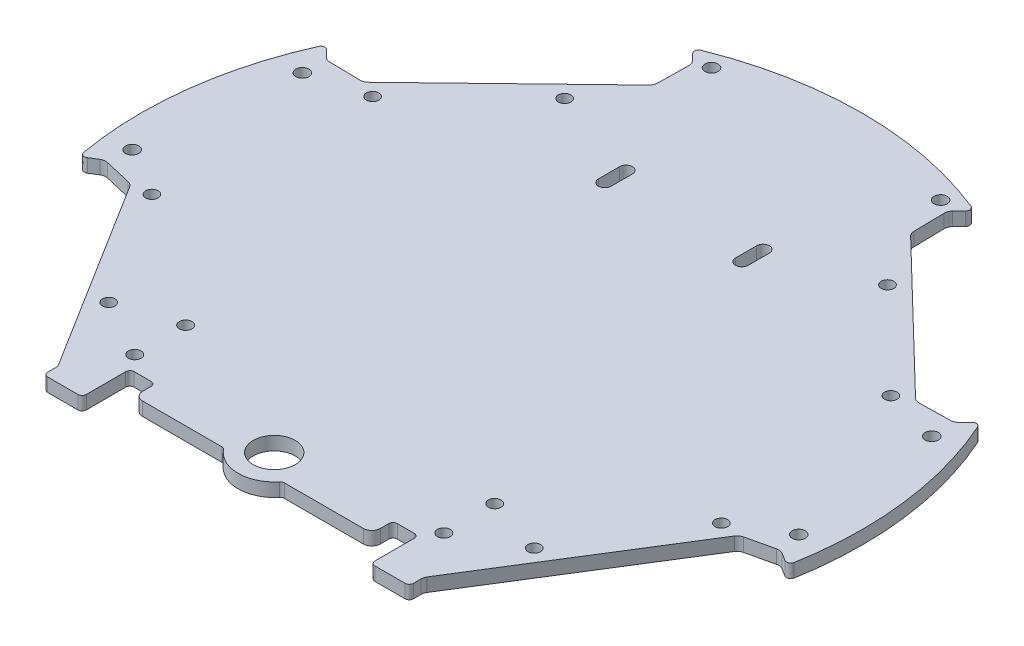
from build123d import *

# Parameters (mm, degrees)
BOSS_EXTRUDE4_DEPTH  = 3.175
SKETCH17_R           = 8.5
BOSS_EXTRUDE5_DEPTH  = 3.175
M3_CLEARANCE_HOLE3_D = 3
M3_CLEARANCE_HOLE1_D = 3.1
M3_CLEARANCE_HOLE4_D = 2.95
M3_CLEARANCE_HOLE2_D = 3.1
CUT_EXTRUDE1_DEPTH   = 121.250075364
BOSS_EXTRUDE6_DEPTH  = 3.175
FILLET1_R            = 2
FILLET3_R            = 1
SKETCH23_R           = 4.95
CUT_EXTRUDE2_DEPTH   = 121.250075364


with BuildPart() as part:
    # Sketch1 → Boss-Extrude4 (new body)
    with BuildSketch(Plane(origin=(0, 0, 0), x_dir=(1, 0, 0), z_dir=(0, 1, 0))):
        with BuildLine():
            Line((-62.799553621, 32.496136604), (-73.969425011, 32.691107434))
            Line((-73.969425011, 32.691107434), (-77.053684287, 35.88495141))
            ThreePointArc((-77.053684287, 35.88495141), (-84.36642289, 10.358894189), (-83.446216027, -16.178041625))
            Line((-83.446216027, -16.178041625), (-79.680911643, -13.825218315))
            Line((-79.680911643, -13.825218315), (-69.484649137, -16.179210996))
            Line((-69.484649137, -16.179210996), (-43.094490772, -58.412292655))
            Line((-43.094490772, -58.412292655), (-43.094490772, -64.826600275))
            Line((-43.094490772, -64.826600275), (-34, -64.826600275))
            Line((-34, -64.826600275), (-34, -58.55))
            Line((-34, -58.55), (-34, -53.55))
            Line((-34, -53.55), (-28, -53.55))
            Line((-28, -53.55), (-28, -58.55))
            Line((-28, -58.55), (28, -58.55))
            Line((28, -58.55), (28, -53.55))
            Line((28, -53.55), (34, -53.55))
            Line((34, -53.55), (34, -58.55))
            Line((34, -58.55), (34, -64.826600275))
            Line((34, -64.826600275), (43.094490772, -64.826600275))
            Line((43.094490772, -64.826600275), (43.094490772, -58.412292655))
            Line((43.094490772, -58.412292655), (69.484649137, -16.179210996))
            Line((69.484649137, -16.179210996), (79.680911643, -13.825218315))
            Line((79.680911643, -13.825218315), (83.446216027, -16.178041625))
            ThreePointArc((83.446216027, -16.178041625), (84.610662337, -8.126242604), (85, 0))
            ThreePointArc((85, 0), (82.98964744, 18.377116688), (77.053684287, 35.88495141))
            Line((77.053684287, 35.88495141), (73.969425011, 32.691107434))
            Line((73.969425011, 32.691107434), (62.799553621, 32.496136604))
            Line((62.799553621, 32.496136604), (30.284668021, 63.895396642))
            Line((30.284668021, 63.895396642), (30.089697191, 75.065268032))
            Line((30.089697191, 75.065268032), (33.173956467, 78.259112008))
            ThreePointArc((33.173956467, 78.259112008), (0, 85), (-33.173956467, 78.259112008))
            Line((-33.173956467, 78.259112008), (-30.089697191, 75.065268032))
            Line((-30.089697191, 75.065268032), (-30.284668021, 63.895396642))
            Line((-30.284668021, 63.895396642), (-62.799553621, 32.496136604))
        make_face()
    extrude(amount=BOSS_EXTRUDE4_DEPTH)

    # Sketch17 → Boss-Extrude5 (add)
    with BuildSketch(Plane(origin=(0, 3.175, 0), x_dir=(1, 0, 0), z_dir=(0, 1, 0))):
        with Locations((0, -53.55)):
            Circle(SKETCH17_R)
    extrude(amount=-BOSS_EXTRUDE5_DEPTH)

    # M3 Clearance Hole3 (through all)
    with Locations(Plane(origin=(0, 0, 0), x_dir=(-1, 0, 0), z_dir=(0, -1, 0))):
        with Locations((36.415, -50), (36.415, -38), (-36.415, -50), (-36.415, -38)):
            Hole(M3_CLEARANCE_HOLE3_D / 2)

    # M3 Clearance Hole1 (through all)
    with Locations(Plane(origin=(0, 3.175, 0), x_dir=(1, 0, 0), z_dir=(0, 1, 0))):
        with Locations((-78.542321426, -8.49139241), (78.542321426, -8.49139241), (74.155025063, 27.240269049), (-74.155025063, 27.240269049)):
            Hole(M3_CLEARANCE_HOLE1_D / 2)

    # M3 Clearance Hole4 (through all)
    with Locations(Plane(origin=(0, 0, 0), x_dir=(-1, 0, 0), z_dir=(0, -1, 0))):
        with Locations((-67.099301622, -15.278865202), (-50.141885166, -42.416404279), (-61.062544382, 30.698137949), (-38.043670771, 52.927205804), (50.141885166, -42.416404279), (67.099301622, -15.278865202), (38.043670771, 52.927205804), (61.062544382, 30.698137949)):
            Hole(M3_CLEARANCE_HOLE4_D / 2)

    # M3 Clearance Hole2 (through all)
    with Locations(Plane(origin=(0, 3.175, 0), x_dir=(1, 0, 0), z_dir=(0, 1, 0))):
        with Locations((27, 76.497766718), (-27, 76.497766718)):
            Hole(M3_CLEARANCE_HOLE2_D / 2)

    # Sketch20 → Cut-Extrude1 (cut, through all)
    with BuildSketch(Plane(origin=(0, 3.175, 0), x_dir=(1, 0, 0), z_dir=(0, 1, 0))):
        with BuildLine():
            Line((-14.64850035, 45.5), (-14.64850035, 40.5))
            ThreePointArc((-14.64850035, 40.5), (-16.14850035, 39), (-17.64850035, 40.5))
            Line((-17.64850035, 40.5), (-17.64850035, 45.5))
            ThreePointArc((-17.64850035, 45.5), (-16.14850035, 47), (-14.64850035, 45.5))
        make_face()
        with BuildLine():
            Line((14.64850035, 45.5), (14.64850035, 40.5))
            ThreePointArc((14.64850035, 40.5), (16.14850035, 39), (17.64850035, 40.5))
            Line((17.64850035, 40.5), (17.64850035, 45.5))
            ThreePointArc((17.64850035, 45.5), (16.14850035, 47), (14.64850035, 45.5))
        make_face()
    extrude(amount=-CUT_EXTRUDE1_DEPTH, mode=Mode.SUBTRACT)

    # Sketch22 → Boss-Extrude6 (add)
    with BuildSketch(Plane(origin=(0, 3.175, 0), x_dir=(1, 0, 0), z_dir=(0, 1, 0))):
        Polygon((-30.284668021, 63.895396642), (-30.245177733, 66.157793715), (-65.061950694, 32.535626892), (-62.799553621, 32.496136604), align=None)
        Polygon((-69.484649137, -16.179210996), (-71.689396914, -15.670204865), (-43.094490772, -61.431620518), (-43.094490772, -58.412292655), align=None)
        Polygon((43.094490772, -61.431620518), (71.689396914, -15.670204865), (69.484649137, -16.179210996), (43.094490772, -58.412292655), align=None)
        Polygon((65.061950694, 32.535626892), (30.245177733, 66.157793715), (30.284668021, 63.895396642), (62.799553621, 32.496136604), align=None)
    extrude(amount=-BOSS_EXTRUDE6_DEPTH)

    # Fillet1
    fillet1_edges = [part.edges().sort_by_distance(p)[0] for p in [
        (-30.245177733, 1.5875, -66.157793715),
        (-65.061950694, 1.5875, -32.535626892),
        (-71.689396914, 1.5875, 15.670204865),
        (-43.094490772, 1.5875, 61.431620518),
        (43.094490772, 1.5875, 61.431620518),
        (71.689396914, 1.5875, 15.670204865),
        (65.061950694, 1.5875, -32.535626892),
        (30.245177733, 1.5875, -66.157793715),
        (30.089697191, 1.5875, -75.065268032),
        (73.969425011, 1.5875, -32.691107434),
        (79.680911643, 1.5875, 13.825218315),
        (28, 1.5875, 58.55),
        (-28, 1.5875, 58.55),
        (-79.680911643, 1.5875, 13.825218315),
        (-73.969425011, 1.5875, -32.691107434),
        (-30.089697191, 1.5875, -75.065268032),
    ]]
    fillet(fillet1_edges, radius=FILLET1_R)

    # Fillet3
    fillet3_edges = [part.edges().sort_by_distance(p)[0] for p in [
        (33.173956467, 1.5875, -78.259112008),
        (77.053684287, 1.5875, -35.88495141),
        (83.446216027, 1.5875, 16.178041625),
        (43.094490772, 1.5875, 64.826600275),
        (34, 1.5875, 64.826600275),
        (34, 1.5875, 53.55),
        (28, 1.5875, 53.55),
        (-28, 1.5875, 53.55),
        (-34, 1.5875, 53.55),
        (-34, 1.5875, 64.826600275),
        (-43.094490772, 1.5875, 64.826600275),
        (-83.446216027, 1.5875, 16.178041625),
        (-77.053684287, 1.5875, -35.88495141),
        (-33.173956467, 1.5875, -78.259112008),
        (-6.873863542, 1.5875, 58.55),
        (6.873863542, 1.5875, 58.55),
    ]]
    fillet(fillet3_edges, radius=FILLET3_R)

    # Sketch23 → Cut-Extrude2 (cut, through all)
    with BuildSketch(Plane(origin=(0, 3.175, 0), x_dir=(1, 0, 0), z_dir=(0, 1, 0))):
        with Locations(Location((0, -53.55, 0), (0, 0, 270))):
            Circle(SKETCH23_R)
    extrude(amount=-CUT_EXTRUDE2_DEPTH, mode=Mode.SUBTRACT)


solid = part.part
